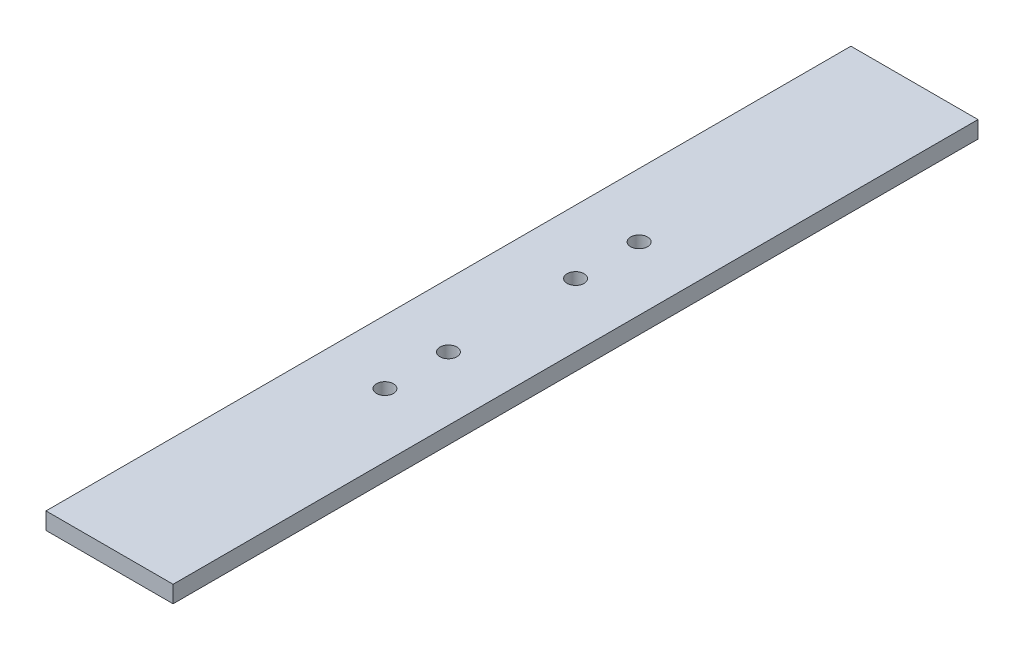
from build123d import *

# Parameters (mm, degrees)
SKETCH1_W           = 15
SKETCH1_H           = 95
SKETCH1_R           = 1
BOSS_EXTRUDE1_DEPTH = 2


with BuildPart() as part:
    # Sketch1 → Boss-Extrude1 (new body)
    with BuildSketch(Plane(origin=(0, 0, 0), x_dir=(1, 0, 0), z_dir=(0, 1, 0))):
        with Locations((-57.5, 0)):
            Rectangle(SKETCH1_W, SKETCH1_H)
        with Locations(Location((-57.5, 15, 0), (0, 0, 270))):
            Circle(SKETCH1_R, mode=Mode.SUBTRACT)
        with Locations(Location((-57.5, -7.5, 0), (0, 0, 270))):
            Circle(SKETCH1_R, mode=Mode.SUBTRACT)
        with Locations(Location((-57.5, -15, 0), (0, 0, 270))):
            Circle(SKETCH1_R, mode=Mode.SUBTRACT)
        with Locations(Location((-57.5, 7.5, 0), (0, 0, 270))):
            Circle(SKETCH1_R, mode=Mode.SUBTRACT)
    extrude(amount=BOSS_EXTRUDE1_DEPTH)


solid = part.part
